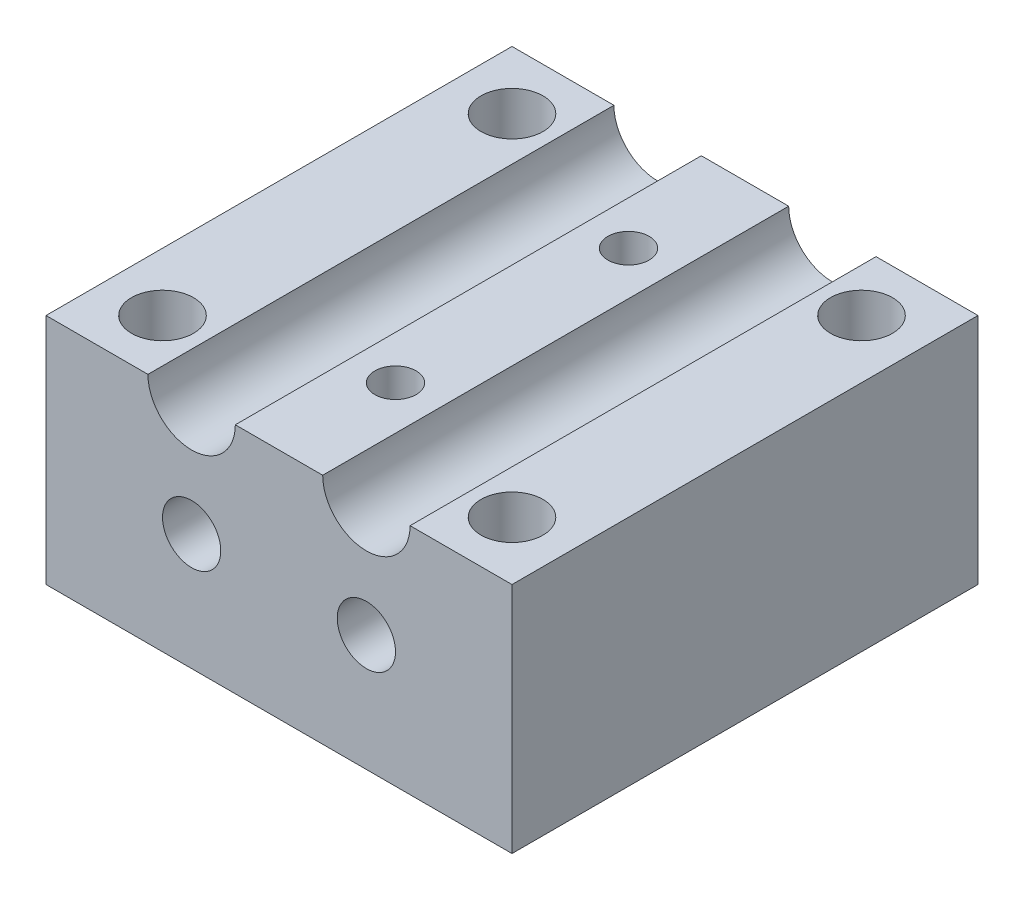
from build123d import *

# Parameters (mm, degrees)
SKETCH1_W               = 50.8
SKETCH1_H               = 50.8
BOSS_EXTRUDE1_DEPTH     = 25.4
SKETCH2_R               = 4.7625
CUT_EXTRUDE1_DEPTH      = 63.217039467
F_1_4_CLEARANCE_HOLE1_D = 6.7564
SKETCH6_R               = 3.175
CUT_EXTRUDE2_DEPTH      = 63.217039467
F_8_CLEARANCE_HOLE1_D   = 4.4958


with BuildPart() as part:
    # Sketch1 → Boss-Extrude1 (new body)
    with BuildSketch(Plane(origin=(0, 0, 0), x_dir=(1, 0, 0), z_dir=(0, 1, 0))):
        Rectangle(SKETCH1_W, SKETCH1_H)
    extrude(amount=BOSS_EXTRUDE1_DEPTH)

    # Sketch2 → Cut-Extrude1 (cut, through all)
    with BuildSketch(Plane.XY.offset(25.4)):
        with Locations((-9.525, 25.4)):
            Circle(SKETCH2_R)
        with Locations((9.525, 25.4)):
            Circle(SKETCH2_R)
    extrude(amount=-CUT_EXTRUDE1_DEPTH, mode=Mode.SUBTRACT)

    # 1/4 Clearance Hole1 (through all)
    with Locations(Plane(origin=(0, 25.4, 0), x_dir=(1, 0, 0), z_dir=(0, 1, 0))):
        with Locations((-19.05, 19.05), (-19.05, -19.05), (19.05, -19.05), (19.05, 19.05)):
            Hole(F_1_4_CLEARANCE_HOLE1_D / 2)

    # Sketch6 → Cut-Extrude2 (cut, through all)
    with BuildSketch(Plane.XY.offset(25.4)):
        with Locations((-9.525, 12.7)):
            Circle(SKETCH6_R)
        with Locations((9.525, 12.7)):
            Circle(SKETCH6_R)
    extrude(amount=-CUT_EXTRUDE2_DEPTH, mode=Mode.SUBTRACT)

    # #8 Clearance Hole1 (through all)
    with Locations(Plane(origin=(0, 25.4, 0), x_dir=(1, 0, 0), z_dir=(0, 1, 0))):
        with Locations((0, 12.7), (0, -12.7)):
            Hole(F_8_CLEARANCE_HOLE1_D / 2)


solid = part.part
